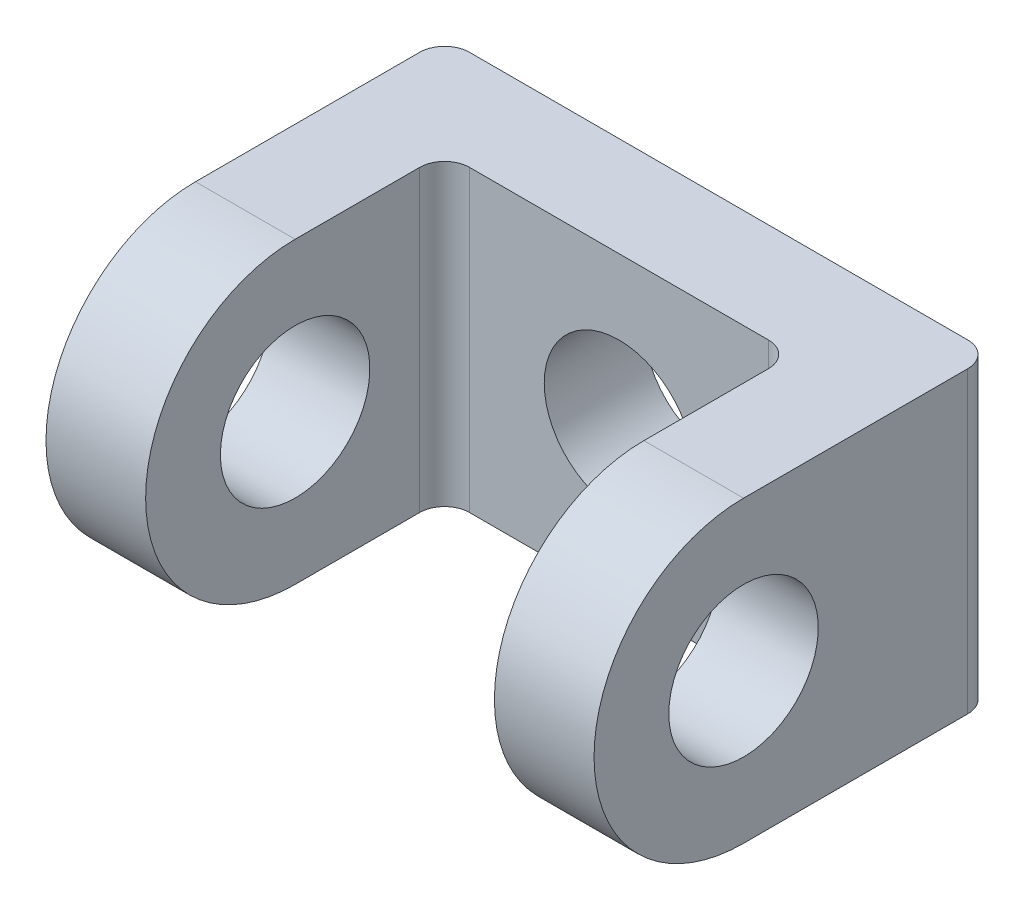
from build123d import *

# Parameters (mm, degrees)
BOSS_EXTRUDE1_DEPTH     = 55
CUT_EXTRUDE1_DEPTH      = 81.156097709
CUT_EXTRUDE1_DEPTH_BACK = 81.156097709
SKETCH2_W               = 70
SKETCH2_H               = 60
CUT_EXTRUDE4_DEPTH      = 125.49899598
CUT_EXTRUDE4_DEPTH_BACK = 125.49899598
SKETCH5_R               = 15
FILLET1_R               = 5
CUT_EXTRUDE5_DEPTH      = 87.746757864
CUT_EXTRUDE5_DEPTH_BACK = 87.746757864
SKETCH6_R               = 15


with BuildPart() as part:
    # Sketch1 → Boss-Extrude1 (new, symmetric)
    with BuildSketch(Plane(origin=(0, 0, 0), x_dir=(0, 0, -1), z_dir=(1, 0, 0))):
        with BuildLine():
            Line((0, 30), (50, 30))
            Line((50, 30), (50, -30))
            Line((50, -30), (0, -30))
            ThreePointArc((0, -30), (-30, 0), (0, 30))
        make_face()
    extrude(amount=BOSS_EXTRUDE1_DEPTH, both=True)

    # Sketch2 → Cut-Extrude1 (cut, two sides: drawn at the far end of the back side and taken through both)
    with BuildSketch(Plane(origin=(0, 0, 0), x_dir=(1, 0, 0), z_dir=(0, 1, 0)).offset(-CUT_EXTRUDE1_DEPTH_BACK)):
        Rectangle(SKETCH2_W, SKETCH2_H)
    extrude(amount=CUT_EXTRUDE1_DEPTH + CUT_EXTRUDE1_DEPTH_BACK, mode=Mode.SUBTRACT)

    # Sketch5 → Cut-Extrude4 (cut, two sides: drawn at the far end of the back side and taken through both)
    with BuildSketch(Plane.ZY.offset(55).offset(-CUT_EXTRUDE4_DEPTH_BACK)):
        Circle(SKETCH5_R)
    extrude(amount=CUT_EXTRUDE4_DEPTH + CUT_EXTRUDE4_DEPTH_BACK, mode=Mode.SUBTRACT)

    # Fillet1
    fillet1_edges = [part.edges().sort_by_distance(p)[0] for p in [
        (55, 0, -50),
        (35, 0, -30),
        (-35, 0, -30),
        (-55, 0, -50),
    ]]
    fillet(fillet1_edges, radius=FILLET1_R)

    # Sketch6 → Cut-Extrude5 (cut, two sides: drawn at the far end of the back side and taken through both)
    with BuildSketch(Plane.XY.offset(-30).offset(-CUT_EXTRUDE5_DEPTH_BACK)):
        Circle(SKETCH6_R)
    extrude(amount=CUT_EXTRUDE5_DEPTH + CUT_EXTRUDE5_DEPTH_BACK, mode=Mode.SUBTRACT)


solid = part.part
